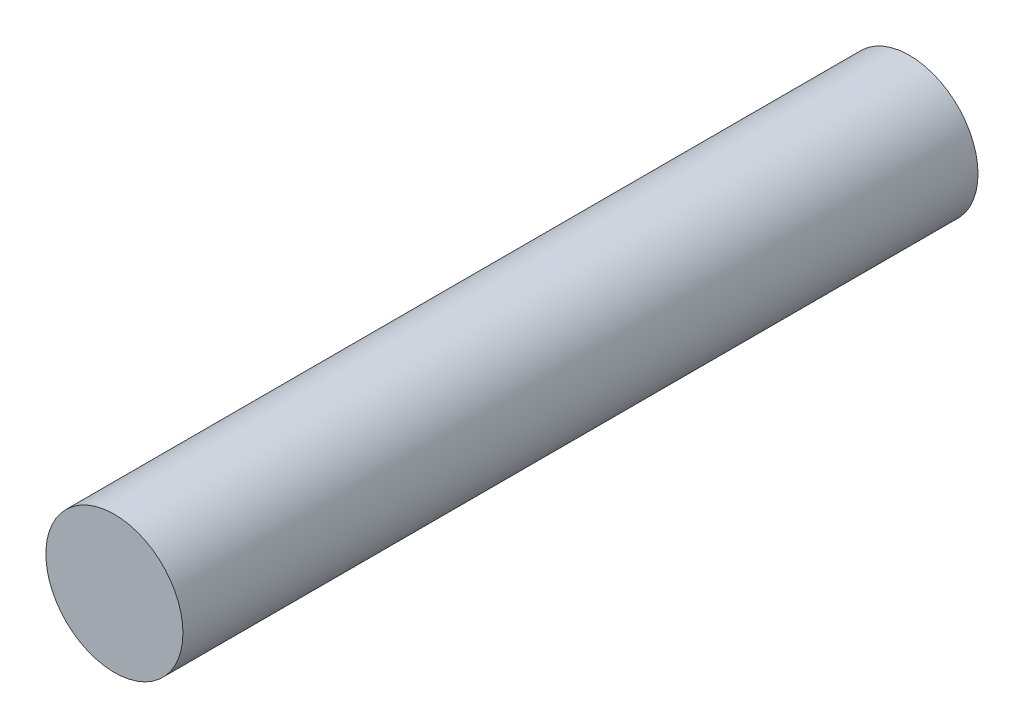
from build123d import *

# Parameters (mm, degrees)
SKETCH1_R           = 3.175
BOSS_EXTRUDE1_DEPTH = 36.83


with BuildPart() as part:
    # Sketch1 → Boss-Extrude1 (new body)
    with BuildSketch(Plane.XY):
        Circle(SKETCH1_R)
    extrude(amount=BOSS_EXTRUDE1_DEPTH)


solid = part.part
